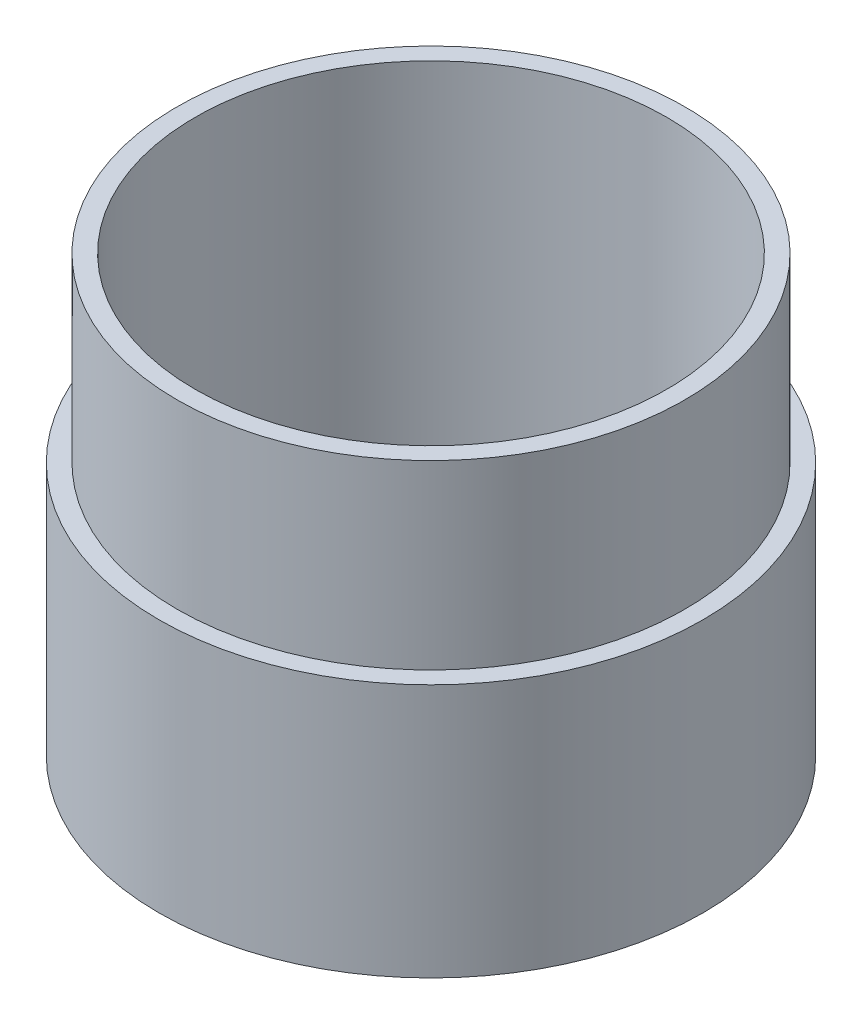
from build123d import *

# Parameters (mm, degrees)
SKETCH1_R           = 37.5
BOSS_EXTRUDE1_DEPTH = 35
SKETCH2_R           = 35
BOSS_EXTRUDE2_DEPTH = 25
SKETCH3_R           = 32.5
CUT_EXTRUDE1_DEPTH  = 59


with BuildPart() as part:
    # Sketch1 → Boss-Extrude1 (new body)
    with BuildSketch(Plane(origin=(0, 0, 0), x_dir=(1, 0, 0), z_dir=(0, 1, 0))):
        with Locations(Location((0, 0, 0), (0, 0, 270))):
            Circle(SKETCH1_R)
    extrude(amount=BOSS_EXTRUDE1_DEPTH)

    # Sketch2 → Boss-Extrude2 (add)
    with BuildSketch(Plane(origin=(0, 35, 0), x_dir=(1, 0, 0), z_dir=(0, 1, 0))):
        with Locations(Location((0, 0, 0), (0, 0, 270))):
            Circle(SKETCH2_R)
    extrude(amount=BOSS_EXTRUDE2_DEPTH)

    # Sketch3 → Cut-Extrude1 (cut)
    with BuildSketch(Plane(origin=(0, 60, 0), x_dir=(1, 0, 0), z_dir=(0, 1, 0))):
        with Locations(Location((0, 0, 0), (0, 0, 270))):
            Circle(SKETCH3_R)
    extrude(amount=-CUT_EXTRUDE1_DEPTH, mode=Mode.SUBTRACT)


solid = part.part
